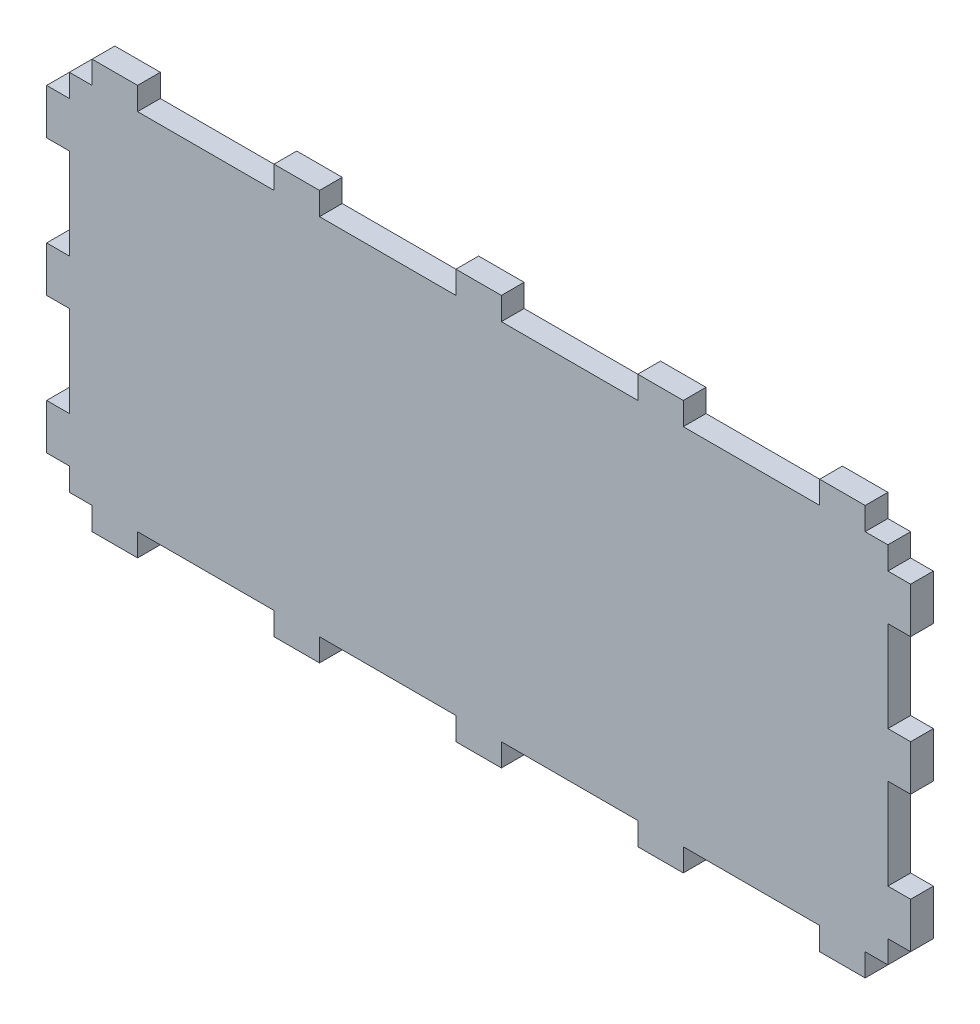
from build123d import *

# Parameters (mm, degrees)
BOSS_EXTRUDE1_DEPTH = 5


with BuildPart() as part:
    # Sketch1 → Boss-Extrude1 (new body)
    with BuildSketch(Plane.XY):
        Polygon((-85, 40), (-85, 45), (-75, 45), (-75, 40), (-45, 40), (-45, 45), (-35, 45), (-35, 40), (-5, 40), (-5, 45), (5, 45), (5, 40), (35, 40), (35, 45), (45, 45), (45, 40), (75, 40), (75, 45), (85, 45), (85, 40), (90, 40), (90, 35), (95, 35), (95, 25), (90, 25), (90, 5), (95, 5), (95, -5), (90, -5), (90, -25), (95, -25), (95, -35), (90, -35), (90, -40), (85, -40), (85, -45), (75, -45), (75, -40), (45, -40), (45, -45), (35, -45), (35, -40), (5, -40), (5, -45), (-5, -45), (-5, -40), (-35, -40), (-35, -45), (-45, -45), (-45, -40), (-75, -40), (-75, -45), (-85, -45), (-85, -40), (-90, -40), (-90, -35), (-95, -35), (-95, -25), (-90, -25), (-90, -5), (-95, -5), (-95, 5), (-90, 5), (-90, 25), (-95, 25), (-95, 35), (-90, 35), (-90, 40), align=None)
    extrude(amount=BOSS_EXTRUDE1_DEPTH)


solid = part.part
